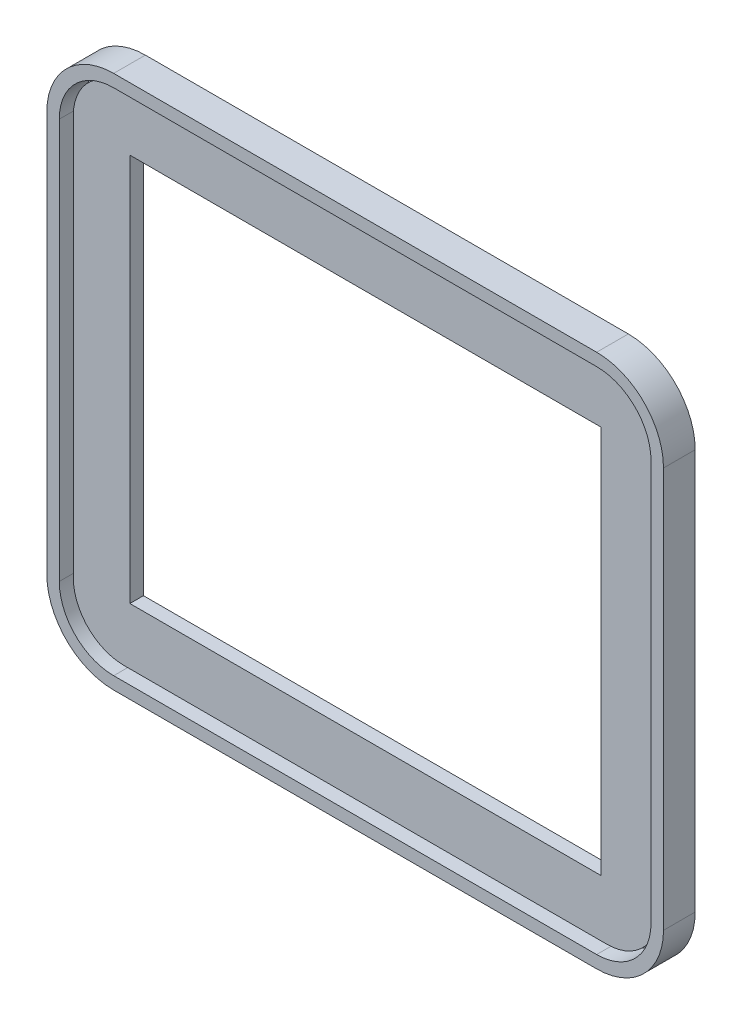
from build123d import *

# Parameters (mm, degrees)
SURFACE_EXTRUDE1_1_DEPTH = 2.8
THICKEN1_T1              = 1.1
BOSS_EXTRUDE1_DEPTH      = 0.7
BOSS_EXTRUDE2_DEPTH      = 1.2
SKETCH5_W                = 41.62
SKETCH5_H                = 34.32
CUT_EXTRUDE1_DEPTH       = 37.098926577


with BuildPart() as body_1:
    # Surface-Extrude1: a surface, the sketch's curves swept straight by 2.8 mm
    with BuildLine(Plane.XY, mode=Mode.PRIVATE) as surface_extrude1_1_path:
        Line((-21.341673888, 22.5), (21.341673888, 22.5))
        ThreePointArc((21.341673888, 22.5), (24.741673888, 21.091673888), (26.15, 17.691673888))
        Line((26.15, 17.691673888), (26.15, -17.691673888))
        ThreePointArc((26.15, -17.691673888), (24.741673888, -21.091673888), (21.341673888, -22.5))
        Line((21.341673888, -22.5), (-21.341673888, -22.5))
        ThreePointArc((-21.341673888, -22.5), (-24.741673888, -21.091673888), (-26.15, -17.691673888))
        Line((-26.15, -17.691673888), (-26.15, 17.691673888))
        ThreePointArc((-26.15, 17.691673888), (-24.741673888, 21.091673888), (-21.341673888, 22.5))
    surface_extrude1_1 = Shell.extrude(surface_extrude1_1_path.wire(), (0 * SURFACE_EXTRUDE1_1_DEPTH, 0 * SURFACE_EXTRUDE1_1_DEPTH, 1 * SURFACE_EXTRUDE1_1_DEPTH))
    add(Solid.thicken(surface_extrude1_1, THICKEN1_T1))

    # Sketch3 → Boss-Extrude1 (add)
    with BuildSketch(Plane(origin=(0, 0, 0), x_dir=(-1, 0, 0), z_dir=(0, 0, -1))):
        with BuildLine():
            Line((-21.341673888, 22.5), (21.341673888, 22.5))
            ThreePointArc((21.341673888, 22.5), (24.741673888, 21.091673888), (26.15, 17.691673888))
            Line((26.15, 17.691673888), (26.15, -17.691673888))
            ThreePointArc((26.15, -17.691673888), (24.741673888, -21.091673888), (21.341673888, -22.5))
            Line((21.341673888, -22.5), (-21.341673888, -22.5))
            ThreePointArc((-21.341673888, -22.5), (-24.741673888, -21.091673888), (-26.15, -17.691673888))
            Line((-26.15, -17.691673888), (-26.15, 17.691673888))
            ThreePointArc((-26.15, 17.691673888), (-24.741673888, 21.091673888), (-21.341673888, 22.5))
        make_face()
        with BuildLine():
            Line((25.25, 17.691673888), (25.25, -17.691673888))
            ThreePointArc((25.25, -17.691673888), (24.105277785, -20.455277785), (21.341673888, -21.6))
            Line((21.341673888, -21.6), (-21.341673888, -21.6))
            ThreePointArc((-21.341673888, -21.6), (-24.105277785, -20.455277785), (-25.25, -17.691673888))
            Line((-25.25, -17.691673888), (-25.25, 17.691673888))
            ThreePointArc((-25.25, 17.691673888), (-24.105277785, 20.455277785), (-21.341673888, 21.6))
            Line((-21.341673888, 21.6), (21.341673888, 21.6))
            ThreePointArc((21.341673888, 21.6), (24.105277785, 20.455277785), (25.25, 17.691673888))
        make_face(mode=Mode.SUBTRACT)
    extrude(amount=-BOSS_EXTRUDE1_DEPTH)


with BuildPart() as body_2:
    # Sketch4 → Boss-Extrude2 (new body)
    with BuildSketch(Plane.XY.offset(0.7)):
        with BuildLine():
            Line((-25.81, 17.691673888), (-25.81, -17.691673888))
            ThreePointArc((-25.81, -17.691673888), (-24.501257582, -20.851257582), (-21.341673888, -22.16))
            Line((-21.341673888, -22.16), (21.341673888, -22.16))
            ThreePointArc((21.341673888, -22.16), (24.501257582, -20.851257582), (25.81, -17.691673888))
            Line((25.81, -17.691673888), (25.81, 17.691673888))
            ThreePointArc((25.81, 17.691673888), (24.501257582, 20.851257582), (21.341673888, 22.16))
            Line((21.341673888, 22.16), (-21.341673888, 22.16))
            ThreePointArc((-21.341673888, 22.16), (-24.501257582, 20.851257582), (-25.81, 17.691673888))
        make_face()
    extrude(amount=BOSS_EXTRUDE2_DEPTH)

    # Sketch5 → Cut-Extrude1 (cut, through all)
    with BuildSketch(Plane.XY.offset(1.9)):
        Rectangle(SKETCH5_W, SKETCH5_H)
    extrude(amount=-CUT_EXTRUDE1_DEPTH, mode=Mode.SUBTRACT)


solid = Compound([body_1.part, body_2.part])
